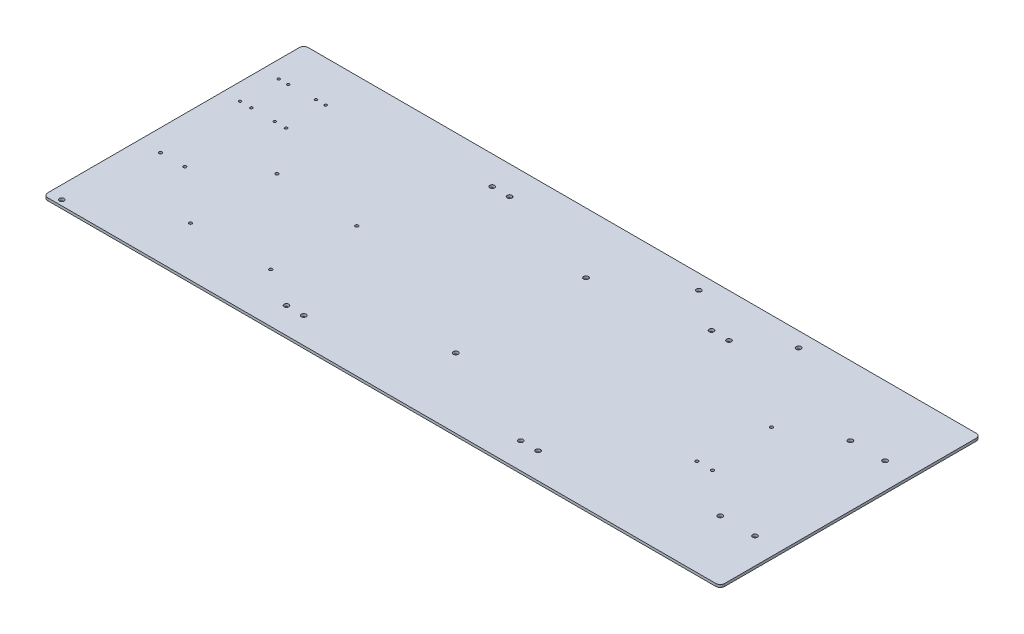
from build123d import *

# Parameters (mm, degrees)
SKETCH2_W           = 780
SKETCH2_H           = 300
BOSS_EXTRUDE1_DEPTH = 3
FILLET1_R           = 5
SKETCH4_R           = 2.75
SKETCH4_R_2         = 1.75
SKETCH4_R_3         = 1.5
CUT_EXTRUDE3_DEPTH  = 10


with BuildPart() as part:
    # Sketch2 → Boss-Extrude1 (new body)
    with BuildSketch(Plane(origin=(0, 0, 0), x_dir=(1, 0, 0), z_dir=(0, 1, 0))):
        Rectangle(SKETCH2_W, SKETCH2_H)
    extrude(amount=BOSS_EXTRUDE1_DEPTH)

    # Fillet1
    fillet1_edges = [part.edges().sort_by_distance(p)[0] for p in [
        (-390, 1.5, -150),
        (390, 1.5, -150),
        (390, 1.5, 150),
        (-390, 1.5, 150),
    ]]
    fillet(fillet1_edges, radius=FILLET1_R)

    # Sketch4 → Cut-Extrude3 (cut)
    with BuildSketch(Plane(origin=(0, 3, 0), x_dir=(1, 0, 0), z_dir=(0, 1, 0))):
        with Locations(Location((5, 80.295408127, 0), (0, 0, 270))):
            Circle(SKETCH4_R)
        with Locations(Location((5, -69.803053448, 0), (0, 0, 270))):
            Circle(SKETCH4_R)
        with Locations(Location((82.5, 132.805328431, 0), (0, 0, 270))):
            Circle(SKETCH4_R)
        with Locations(Location((197.5, 132.805328431, 0), (0, 0, 270))):
            Circle(SKETCH4_R)
        with Locations(Location((130, 100, 0), (0, 0, 270))):
            Circle(SKETCH4_R)
        with Locations(Location((150, 100, 0), (0, 0, 270))):
            Circle(SKETCH4_R)
        with Locations(Location((-276.9, 6, 0), (0, 0, 270))):
            Circle(SKETCH4_R_2)
        with Locations(Location((-178.9, 0, 0), (0, 0, 270))):
            Circle(SKETCH4_R_2)
        with Locations(Location((-185, -93, 0), (0, 0, 270))):
            Circle(SKETCH4_R_2)
        with Locations(Location((-277.5, -93, 0), (0, 0, 270))):
            Circle(SKETCH4_R_2)
        with Locations(Location((360, -80, 0), (0, 0, 270))):
            Circle(SKETCH4_R)
        with Locations(Location((270, -38.928899428, 0), (0, 0, 270))):
            Circle(SKETCH4_R_2)
        with Locations(Location((261, 38.071100572, 0), (0, 0, 270))):
            Circle(SKETCH4_R_2)
        with Locations(Location((-328.292899545, 102.490587084, 0), (0, 0, 270))):
            Circle(SKETCH4_R_3)
        with Locations(Location((-317.292899545, 102.490587084, 0), (0, 0, 270))):
            Circle(SKETCH4_R_3)
        with Locations(Location((-330.292899545, 56.848781738, 0), (0, 0, 270))):
            Circle(SKETCH4_R_3)
        with Locations(Location((-317.292899545, 56.848781738, 0), (0, 0, 270))):
            Circle(SKETCH4_R_3)
        with Locations(Location((-370.506562807, 57.144862602, 0), (0, 0, 270))):
            Circle(SKETCH4_R_3)
        with Locations(Location((-357.506562807, 57.144862602, 0), (0, 0, 270))):
            Circle(SKETCH4_R_3)
        with Locations(Location((-365, -40, 0), (0, 0, 270))):
            Circle(SKETCH4_R_2)
        with Locations(Location((-337.1, -40, 0), (0, 0, 270))):
            Circle(SKETCH4_R_2)
        with Locations(Location((-375, -144, 0), (0, 0, 270))):
            Circle(SKETCH4_R)
        with Locations(Location((-140, -120, 0), (0, 0, 270))):
            Circle(SKETCH4_R)
        with Locations(Location((-120, -120, 0), (0, 0, 270))):
            Circle(SKETCH4_R)
        with Locations(Location((360, 70, 0), (0, 0, 270))):
            Circle(SKETCH4_R)
        with Locations(Location((130, -120, 0), (0, 0, 270))):
            Circle(SKETCH4_R)
        with Locations(Location((150, -120, 0), (0, 0, 270))):
            Circle(SKETCH4_R)
        with Locations(Location((320, -80, 0), (0, 0, 270))):
            Circle(SKETCH4_R)
        with Locations(Location((320, 70, 0), (0, 0, 270))):
            Circle(SKETCH4_R)
        with Locations(Location((252, -38.928899428, 0), (0, 0, 270))):
            Circle(SKETCH4_R_2)
        with Locations(Location((-140, 117.187380821, 0), (0, 0, 270))):
            Circle(SKETCH4_R)
        with Locations(Location((-120, 117.187380821, 0), (0, 0, 270))):
            Circle(SKETCH4_R)
        with Locations(Location((-370.506562807, 101.610482847, 0), (0, 0, 270))):
            Circle(SKETCH4_R_3)
        with Locations(Location((-359.506562807, 101.610482847, 0), (0, 0, 270))):
            Circle(SKETCH4_R_3)
    extrude(amount=-CUT_EXTRUDE3_DEPTH, mode=Mode.SUBTRACT)


solid = part.part
